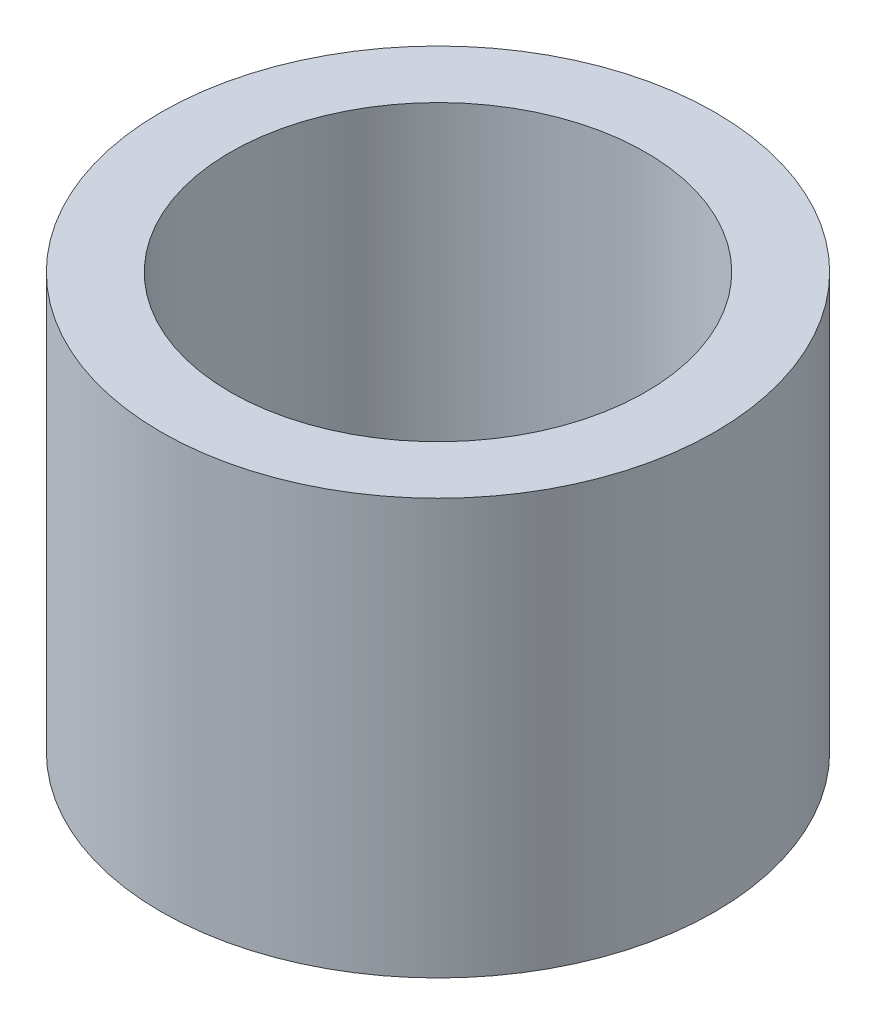
from build123d import *

# Parameters (mm, degrees)
SKETCH1_R           = 4
SKETCH1_R_2         = 3
BOSS_EXTRUDE1_DEPTH = 6


with BuildPart() as part:
    # Sketch1 → Boss-Extrude1 (new body)
    with BuildSketch(Plane(origin=(0, 0, 0), x_dir=(1, 0, 0), z_dir=(0, 1, 0))):
        with Locations(Location((0, 0, 0), (0, 0, 270))):
            Circle(SKETCH1_R)
        with Locations(Location((0, 0, 0), (0, 0, 270))):
            Circle(SKETCH1_R_2, mode=Mode.SUBTRACT)
    extrude(amount=BOSS_EXTRUDE1_DEPTH)


solid = part.part
